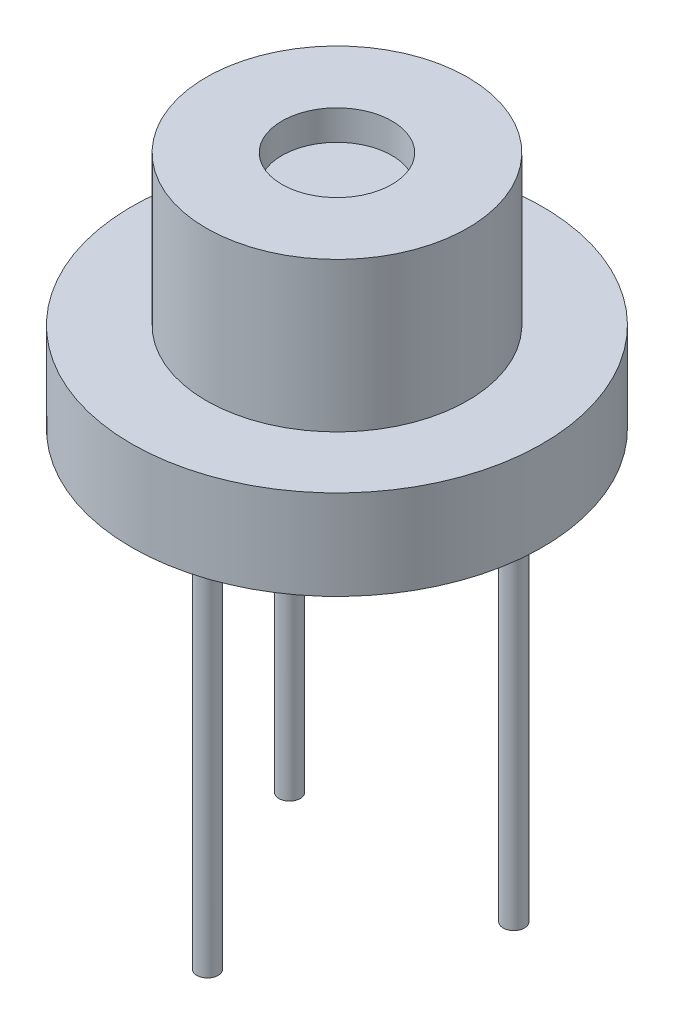
from build123d import *

# Parameters (mm, degrees)
SKETCH1_R           = 2.75
BOSS_EXTRUDE1_DEPTH = 1.2
SKETCH2_R           = 1.75
BOSS_EXTRUDE2_DEPTH = 2
SKETCH3_R           = 0.736254348
CUT_EXTRUDE1_DEPTH  = 0.4
SKETCH4_R           = 0.143122077
BOSS_EXTRUDE3_DEPTH = 5.4


with BuildPart() as part:
    # Sketch1 → Boss-Extrude1 (new body)
    with BuildSketch(Plane(origin=(0, 0, 0), x_dir=(1, 0, 0), z_dir=(0, 1, 0))):
        with Locations(Location((0, 0, 0), (0, 0, 270))):
            Circle(SKETCH1_R)
    extrude(amount=BOSS_EXTRUDE1_DEPTH)

    # Sketch2 → Boss-Extrude2 (add)
    with BuildSketch(Plane(origin=(0, 1.2, 0), x_dir=(1, 0, 0), z_dir=(0, 1, 0))):
        with Locations(Location((0, 0, 0), (0, 0, 270))):
            Circle(SKETCH2_R)
    extrude(amount=BOSS_EXTRUDE2_DEPTH)

    # Sketch3 → Cut-Extrude1 (cut)
    with BuildSketch(Plane(origin=(0, 3.2, 0), x_dir=(1, 0, 0), z_dir=(0, 1, 0))):
        with Locations(Location((0, 0, 0), (0, 0, 270))):
            Circle(SKETCH3_R)
    extrude(amount=-CUT_EXTRUDE1_DEPTH, mode=Mode.SUBTRACT)

    # Sketch4 → Boss-Extrude3 (add)
    with BuildSketch(Plane.XZ):
        with Locations(Location((0, 1.733276442, 0), (0, 0, 90))):
            Circle(SKETCH4_R)
        with Locations(Location((1.501061431, -0.866638221, 0), (0, 0, 90))):
            Circle(SKETCH4_R)
        with Locations(Location((-1.501061431, -0.866638221, 0), (0, 0, 90))):
            Circle(SKETCH4_R)
    extrude(amount=BOSS_EXTRUDE3_DEPTH)


solid = part.part
